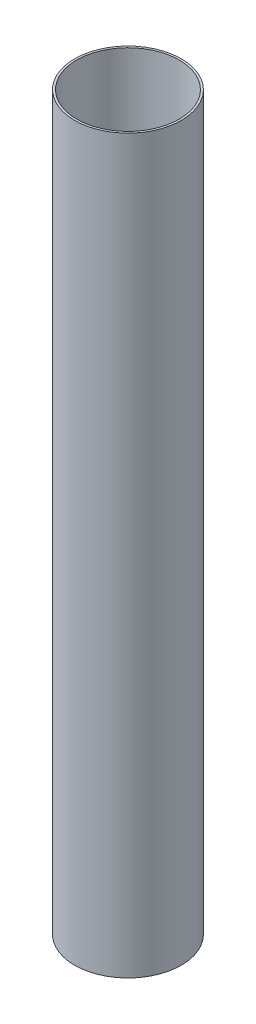
from build123d import *

# Parameters (mm, degrees)
SKETCH1_R           = 51.2
SKETCH1_R_2         = 49.2
BOSS_EXTRUDE1_DEPTH = 702


with BuildPart() as part:
    # Sketch1 → Boss-Extrude1 (new body)
    with BuildSketch(Plane(origin=(0, 0, 0), x_dir=(1, 0, 0), z_dir=(0, 1, 0))):
        with Locations(Location((0, 0, 0), (0, 0, 270))):
            Circle(SKETCH1_R)
        with Locations(Location((0, 0, 0), (0, 0, 270))):
            Circle(SKETCH1_R_2, mode=Mode.SUBTRACT)
    extrude(amount=BOSS_EXTRUDE1_DEPTH)


solid = part.part
